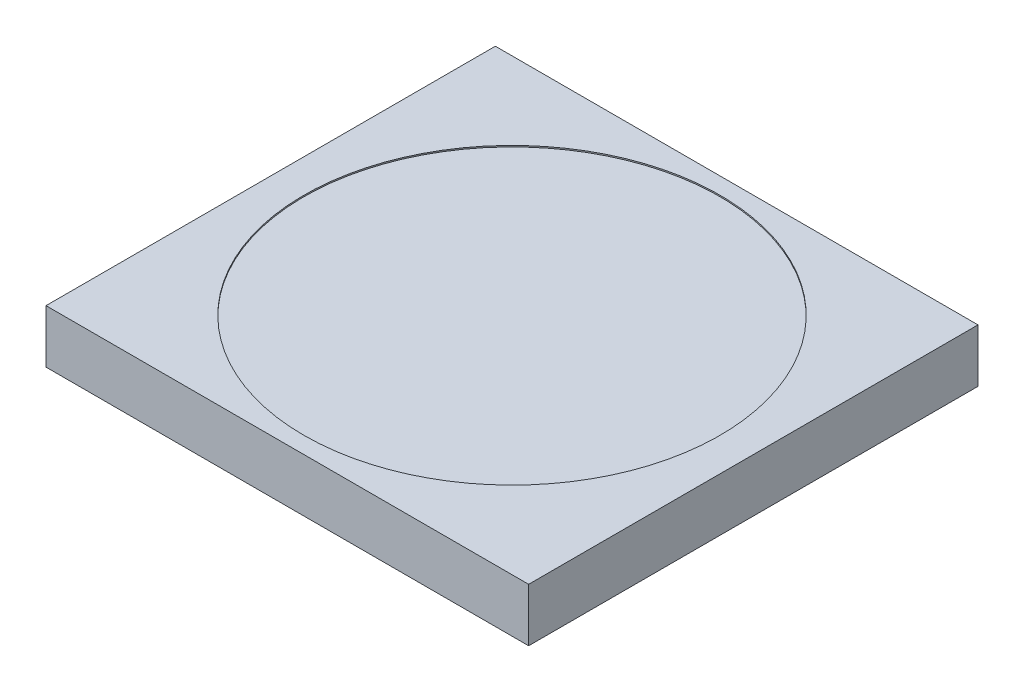
from build123d import *

# Parameters (mm, degrees)
SKETCH1_W           = 290
SKETCH1_H           = 270
BOSS_EXTRUDE1_DEPTH = 16
SKETCH2_R           = 125
CUT_EXTRUDE1_DEPTH  = 0.8


with BuildPart() as part:
    # Sketch1 → Boss-Extrude1 (new, symmetric)
    with BuildSketch(Plane(origin=(0, 0, 0), x_dir=(1, 0, 0), z_dir=(0, 1, 0))):
        Rectangle(SKETCH1_W, SKETCH1_H)
    extrude(amount=BOSS_EXTRUDE1_DEPTH, both=True)

    # Sketch2 → Cut-Extrude1 (cut)
    with BuildSketch(Plane(origin=(0, 16, 0), x_dir=(1, 0, 0), z_dir=(0, 1, 0))):
        with Locations(Location((0, 0, 0), (0, 0, 270))):
            Circle(SKETCH2_R)
    extrude(amount=-CUT_EXTRUDE1_DEPTH, mode=Mode.SUBTRACT)


solid = part.part
